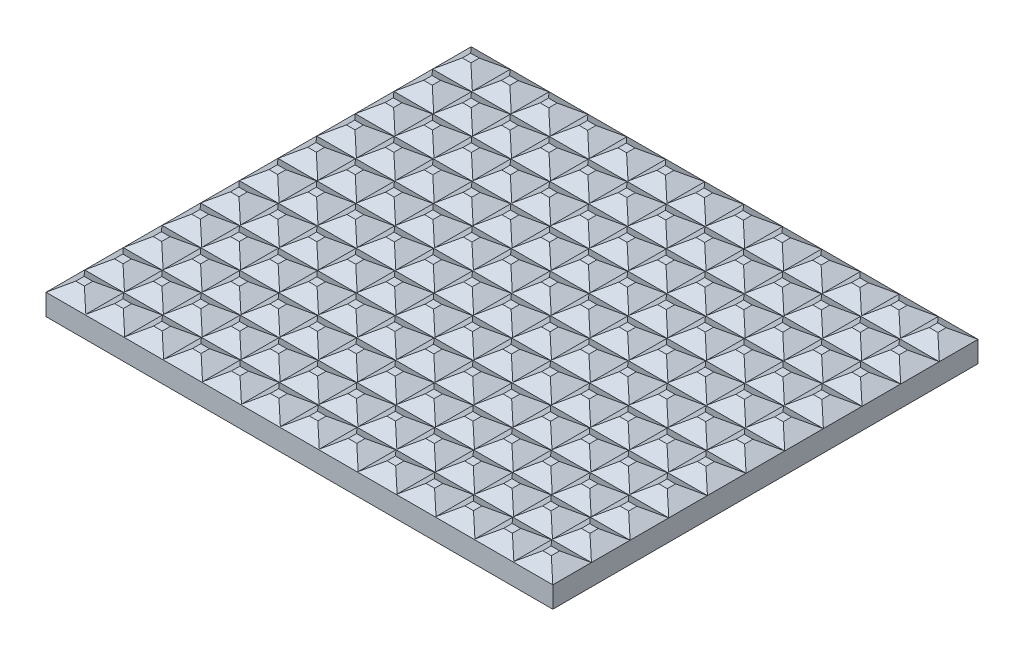
from build123d import *

# Parameters (mm, degrees)
SKETCH1_W               = 59
SKETCH1_H               = 49.5
SKETCH1_R               = 3
BOSS_EXTRUDE1_DEPTH     = 1.5
BOSS_EXTRUDE2_DEPTH     = 49.5
CUT_EXTRUDE1_DEPTH      = 2
CHAMFER3_SIZE           = 1.5
CUT_EXTRUDE6_DEPTH      = 65.105869466
CUT_EXTRUDE7_DEPTH      = 39.714499868
CUT_EXTRUDE7_DEPTH_BACK = 39.714499868
SKETCH10_W              = 62.73135069
SKETCH10_H              = 2.200371666


with BuildPart() as part:
    # Sketch1 → Boss-Extrude1 (new body)
    with BuildSketch(Plane(origin=(0, 0, 0), x_dir=(1, 0, 0), z_dir=(0, 1, 0))):
        Rectangle(SKETCH1_W, SKETCH1_H)
        with Locations(Location((0, 0, 0), (0, 0, 270))):
            Circle(SKETCH1_R, mode=Mode.SUBTRACT)
    extrude(amount=BOSS_EXTRUDE1_DEPTH)

    # Sketch2 → Boss-Extrude2 (add)
    with BuildSketch(Plane(origin=(0, 0, -24.75), x_dir=(-1, 0, 0), z_dir=(0, 0, -1))):
        Polygon((2.265, 2.5), (4.53, 4), (6.795, 2.5), (9.06, 4), (11.325, 2.5), (13.59, 4), (15.855, 2.5), (18.12, 4), (20.385, 2.5), (22.65, 4), (24.915, 2.5), (27.18, 4), (29.445, 2.5), (29.5, 2.463576159), (29.5, 1.5), (-29.5, 1.5), (-29.5, 2.463576159), (-29.445, 2.5), (-27.18, 4), (-24.915, 2.5), (-22.65, 4), (-20.385, 2.5), (-18.12, 4), (-15.855, 2.5), (-13.59, 4), (-11.325, 2.5), (-9.06, 4), (-6.795, 2.5), (-4.53, 4), (-2.265, 2.5), (0, 4), align=None)
    extrude(amount=-BOSS_EXTRUDE2_DEPTH)

    # Sketch3 → Cut-Extrude1 (cut)
    with BuildSketch(Plane(origin=(0, 0, 0), x_dir=(-1, 0, 0), z_dir=(0, -1, 0))):
        with BuildLine():
            Line((-1.75, -2.436698586), (-1.75, -5))
            Line((-1.75, -5), (1.75, -5))
            Line((1.75, -5), (1.75, -2.436698586))
            ThreePointArc((1.75, -2.436698586), (0, 3), (-1.75, -2.436698586))
        make_face()
    extrude(amount=-CUT_EXTRUDE1_DEPTH, mode=Mode.SUBTRACT)

    # Chamfer3
    chamfer3_edges = [part.edges().sort_by_distance(p)[0] for p in [
        (0, 0, 5),
    ]]
    chamfer(chamfer3_edges, length=CHAMFER3_SIZE)

    # Sketch9 → Cut-Extrude6 (cut, through all)
    with BuildSketch(Plane(origin=(29.5, 0, 0), x_dir=(0, 0, -1), z_dir=(1, 0, 0))):
        Polygon((-24.75, 2.463576159), (-22.65, 4), (-20.25, 2.463576159), (-18.15, 4), (-15.75, 2.463576159), (-13.65, 4), (-11.25, 2.463576159), (-9.15, 4), (-6.75, 2.463576159), (-4.65, 4), (-2.25, 2.463576159), (-0.15, 4), (2.25, 2.463576159), (4.35, 4), (6.75, 2.463576159), (8.85, 4), (11.25, 2.463576159), (13.35, 4), (15.75, 2.463576159), (17.85, 4), (20.25, 2.463576159), (22.35, 4), (24.75, 2.463576159), (24.75, 6.408846191), (-24.75, 6.408846191), align=None)
    extrude(amount=-CUT_EXTRUDE6_DEPTH, mode=Mode.SUBTRACT)

    # Sketch10 → Cut-Extrude7 (cut, two sides: drawn at the far end of the back side and taken through both)
    with BuildSketch(Plane.XY.offset(-CUT_EXTRUDE7_DEPTH_BACK)):
        with Locations((-0.208766967, 4.769060005)):
            Rectangle(SKETCH10_W, SKETCH10_H)
    extrude(amount=CUT_EXTRUDE7_DEPTH + CUT_EXTRUDE7_DEPTH_BACK, mode=Mode.SUBTRACT)


solid = part.part
